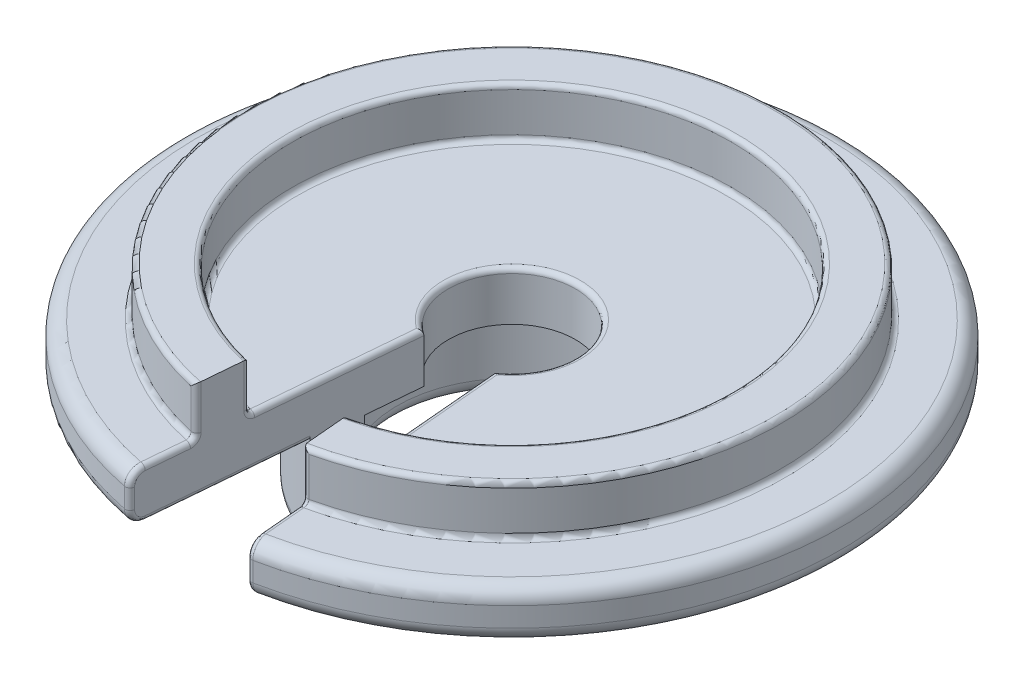
from build123d import *

# Parameters (mm, degrees)
FILLET1_R               = 0.381
CUT_EXTRUDE2_DEPTH      = 13.707935089
CUT_EXTRUDE2_DEPTH_BACK = 13.707935089
FILLET2_R               = 0.127


with BuildPart() as part:
    # Sketch1 → Revolve1 (revolve)
    with BuildSketch(Plane.XY, mode=Mode.PRIVATE) as revolve1_sk:
        Polygon((-1.651, 0), (-1.651, 1.27), (-5.715, 1.27), (-5.715, 2.54), (-6.985, 2.54), (-6.985, 1.27), (-8.5725, 1.27), (-8.5725, 0), (-4.2545, 0), (-4.2545, -2.54), (-2.9845, -2.54), (-2.9845, 0), align=None)
    revolve(revolve1_sk.sketch.rotate(Axis((0, -179.325111384, 0), (0, 1, 0)), 180), axis=Axis((0, -179.325111384, 0), (0, 1, 0)))

    # Fillet1
    fillet1_edges = [part.edges().sort_by_distance(p)[0] for p in [
        (-4.2545, -2.54, 0),
        (-8.5725, 0, 0),
        (-8.5725, 1.27, 0),
        (-2.9845, -2.54, 0),
    ]]
    fillet(fillet1_edges, radius=FILLET1_R)

    # Sketch2 → Cut-Extrude2 (cut, two sides: drawn at the far end of the back side and taken through both)
    with BuildSketch(Plane(origin=(0, 1.27, 0), x_dir=(1, 0, 0), z_dir=(0, 1, 0)).offset(-CUT_EXTRUDE2_DEPTH_BACK)):
        Polygon((-0.79375, 0), (0.79375, 0), (1.543746568, -8.5725), (-1.543746568, -8.5725), align=None)
    extrude(amount=CUT_EXTRUDE2_DEPTH + CUT_EXTRUDE2_DEPTH_BACK, mode=Mode.SUBTRACT)

    # Fillet2
    fillet2_edges = [part.edges().sort_by_distance(p)[0] for p in [
        (-1.52188273, 1.158717065, 8.322595182),
        (1.52188273, 1.158717065, 8.322595182),
        (0, 1.27, -6.985),
        (0, 2.54, -6.985),
        (0, 2.54, -5.715),
        (0, 1.27, -5.715),
        (0, 1.27, -1.651),
        (1.52188273, 0.111282935, 8.322595182),
        (1.325193429, 0, 6.074426186),
        (1.531677949, 0.6350003, 8.434555051),
        (1.445456413, 1.27, 7.449038389),
        (1.392590045, 1.905, 6.84477304),
        (-1.281024943, 1.905, 5.569578089),
        (-1.097531331, 1.27, 3.472236506),
        (-1.325193429, 0, 6.074426186),
        (-1.531677949, 0.6350003, 8.434555051),
        (-1.445456413, 1.27, 7.449038389),
        (-1.392590045, 1.905, 6.84477304),
        (-1.52188273, 0.111282935, 8.322595182),
        (1.281024943, 1.905, 5.569578089),
        (1.097531331, 1.27, 3.472236506),
    ]]
    fillet(fillet2_edges, radius=FILLET2_R)


solid = part.part
